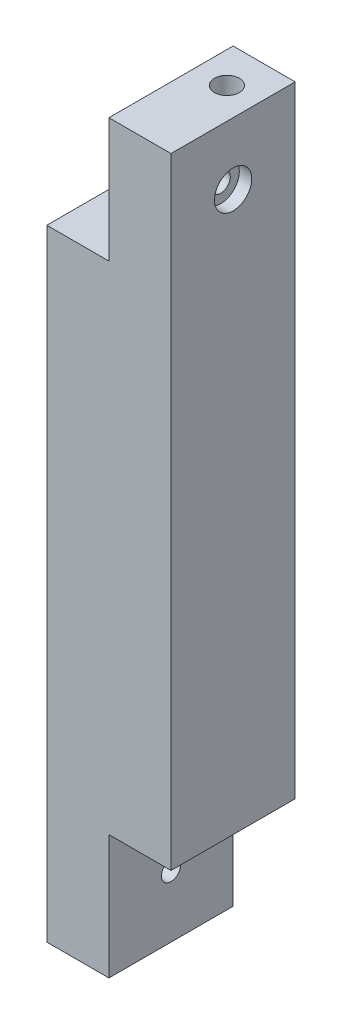
from build123d import *

# Parameters (mm, degrees)
SKETCH_1_W          = 20
SKETCH_1_H          = 20
EXTRUDE_1_DEPTH     = 120
SKETCH_2_W          = 10
SKETCH_2_H          = 20
CUT_EXTRUDE_1_DEPTH = 120
SKETCH_3_W          = 10
SKETCH_3_H          = 20
CUT_EXTRUDE_2_DEPTH = 120
CUT_EXTRUDE_3_DEPTH = 120
SKETCH_5_R          = 3
CUT_EXTRUDE_4_DEPTH = 2
CUT_EXTRUDE_5_DEPTH = 20
SKETCH_7_R          = 3
CUT_EXTRUDE_6_DEPTH = 2
SKETCH_8_R          = 2
CUT_EXTRUDE_7_DEPTH = 100


with BuildPart() as part:
    # 草图1 → 凸台-拉伸1 (new body)
    with BuildSketch(Plane(origin=(0, 0, 0), x_dir=(1, 0, 0), z_dir=(0, 1, 0))):
        with Locations((-7.981321578, -6.453869679)):
            Rectangle(SKETCH_1_W, SKETCH_1_H)
    extrude(amount=EXTRUDE_1_DEPTH)

    # 草图2 → 切除-拉伸1 (cut)
    with BuildSketch(Plane.XY.offset(16.453869679)):
        with Locations((-12.981321578, 110)):
            Rectangle(SKETCH_2_W, SKETCH_2_H)
    extrude(amount=-CUT_EXTRUDE_1_DEPTH, mode=Mode.SUBTRACT)

    # 草图3 → 切除-拉伸2 (cut)
    with BuildSketch(Plane.XY.offset(16.453869679)):
        with Locations((-2.981321578, 10)):
            Rectangle(SKETCH_3_W, SKETCH_3_H)
    extrude(amount=-CUT_EXTRUDE_2_DEPTH, mode=Mode.SUBTRACT)

    # 草图4 → 切除-拉伸3 (cut)
    with BuildSketch(Plane.ZY.offset(7.981321578)):
        with BuildLine():
            ThreePointArc((8.003869679, 110), (7.047028999, 111.432013275), (5.357854168, 111.096015511))
            Line((5.357854168, 111.096015511), (7.549885189, 108.903984489))
            ThreePointArc((7.549885189, 108.903984489), (7.885882954, 109.40684068), (8.003869679, 110))
        make_face()
        with BuildLine():
            Line((7.549885189, 108.903984489), (5.357854168, 111.096015511))
            ThreePointArc((5.357854168, 111.096015511), (5.357854168, 108.903984489), (7.549885189, 108.903984489))
        make_face()
    extrude(amount=-CUT_EXTRUDE_3_DEPTH, mode=Mode.SUBTRACT)

    # 草图5 → 切除-拉伸4 (cut)
    with BuildSketch(Plane(origin=(2.018678422, 0, 0), x_dir=(0, 0, -1), z_dir=(1, 0, 0))):
        with Locations((-6.453869679, 110)):
            Circle(SKETCH_5_R)
    extrude(amount=-CUT_EXTRUDE_4_DEPTH, mode=Mode.SUBTRACT)

    # 草图6 → 切除-拉伸5 (cut)
    with BuildSketch(Plane(origin=(-7.981321578, 0, 0), x_dir=(0, 0, -1), z_dir=(1, 0, 0))):
        with BuildLine():
            ThreePointArc((-4.903869679, 10), (-5.860710358, 11.432013275), (-7.549885189, 11.096015511))
            Line((-7.549885189, 11.096015511), (-5.357854168, 8.903984489))
            ThreePointArc((-5.357854168, 8.903984489), (-5.021856403, 9.40684068), (-4.903869679, 10))
        make_face()
        with BuildLine():
            Line((-5.357854168, 8.903984489), (-7.549885189, 11.096015511))
            ThreePointArc((-7.549885189, 11.096015511), (-7.549885189, 8.903984489), (-5.357854168, 8.903984489))
        make_face()
    extrude(amount=-CUT_EXTRUDE_5_DEPTH, mode=Mode.SUBTRACT)

    # 草图7 → 切除-拉伸6 (cut)
    with BuildSketch(Plane.ZY.offset(17.981321578)):
        with Locations((6.453869679, 10)):
            Circle(SKETCH_7_R)
    extrude(amount=-CUT_EXTRUDE_6_DEPTH, mode=Mode.SUBTRACT)

    # 草图8 → 切除-拉伸7 (cut)
    with BuildSketch(Plane.XZ.offset(-20)):
        with Locations(Location((-2.981321578, 2.453869679, 0), (0, 0, 270))):
            Circle(SKETCH_8_R)
    extrude(amount=-CUT_EXTRUDE_7_DEPTH, mode=Mode.SUBTRACT)


solid = part.part
